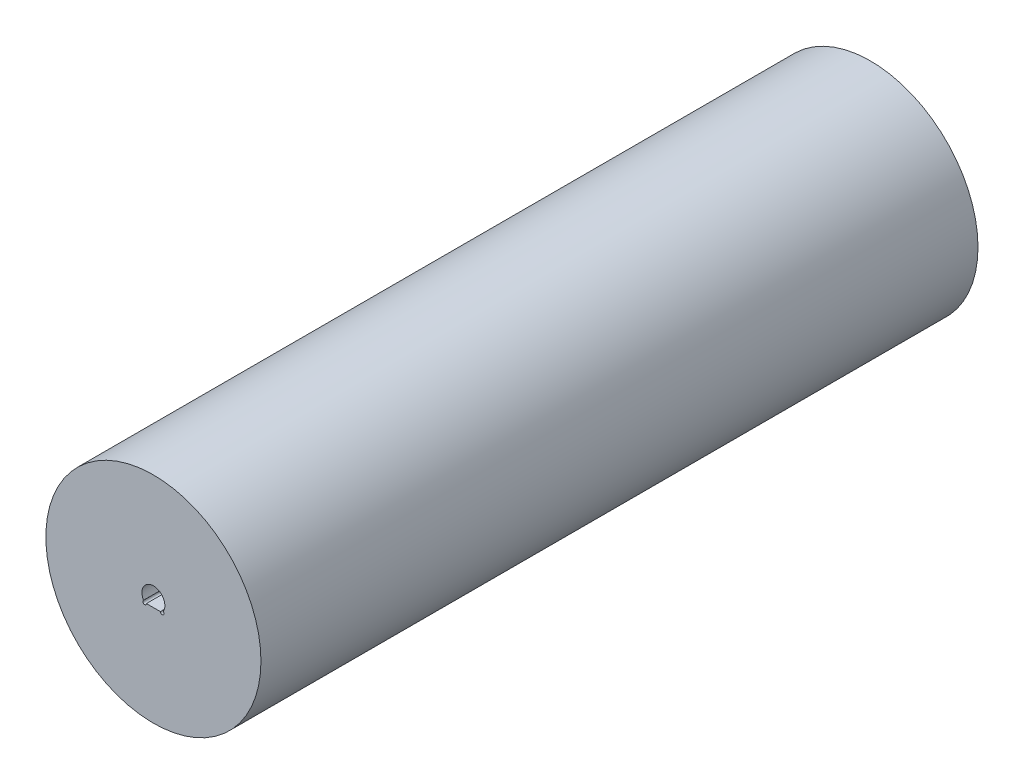
from build123d import *

# Parameters (mm, degrees)
SKETCH1_R           = 15
BOSS_EXTRUDE1_DEPTH = 100
CUT_EXTRUDE1_DEPTH  = 10
SKETCH3_R           = 11
CUT_EXTRUDE2_DEPTH  = 7
SKETCH4_R           = 5
CUT_EXTRUDE3_DEPTH  = 70


with BuildPart() as part:
    # Sketch1 → Boss-Extrude1 (new body)
    with BuildSketch(Plane.XY):
        Circle(SKETCH1_R)
    extrude(amount=BOSS_EXTRUDE1_DEPTH)

    # Sketch2 → Cut-Extrude1 (cut)
    with BuildSketch(Plane.XY.offset(100)):
        with BuildLine():
            Line((-0.975, -1.029259443), (0.975, -1.029259443))
            ThreePointArc((0.975, -1.029259443), (1.339358737, -1.251570214), (1.370376634, -0.82587401))
            ThreePointArc((1.370376634, -0.82587401), (0, 1.6), (-1.370376634, -0.82587401))
            ThreePointArc((-1.370376634, -0.82587401), (-1.339358737, -1.251570214), (-0.975, -1.029259443))
        make_face()
    extrude(amount=-CUT_EXTRUDE1_DEPTH, mode=Mode.SUBTRACT)

    # Sketch3 → Cut-Extrude2 (cut)
    with BuildSketch(Plane(origin=(0, 0, 0), x_dir=(-1, 0, 0), z_dir=(0, 0, -1))):
        Circle(SKETCH3_R)
    extrude(amount=-CUT_EXTRUDE2_DEPTH, mode=Mode.SUBTRACT)

    # Sketch4 → Cut-Extrude3 (cut)
    with BuildSketch(Plane(origin=(0, 0, 7), x_dir=(-1, 0, 0), z_dir=(0, 0, -1))):
        Circle(SKETCH4_R)
    extrude(amount=-CUT_EXTRUDE3_DEPTH, mode=Mode.SUBTRACT)


solid = part.part
